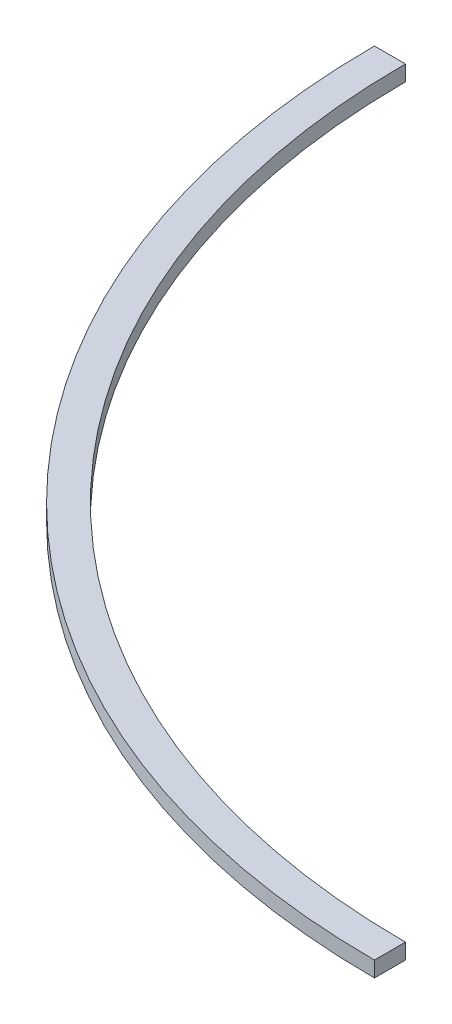
from build123d import *

# Parameters (mm, degrees)
BOSS_EXTRUDE1_DEPTH = 10


with BuildPart() as part:
    # Sketch1 → Boss-Extrude1 (new body)
    with BuildSketch(Plane(origin=(0, 0, 0), x_dir=(1, 0, 0), z_dir=(0, 1, 0))):
        with BuildLine():
            ThreePointArc((0, -490), (-346.482322781, -346.482322781), (-490, 0))
            Line((-490, 0), (-510, 0))
            ThreePointArc((-510, 0), (-360.624458405, -360.624458405), (0, -510))
            Line((0, -510), (0, -490))
        make_face()
    extrude(amount=BOSS_EXTRUDE1_DEPTH)


solid = part.part
